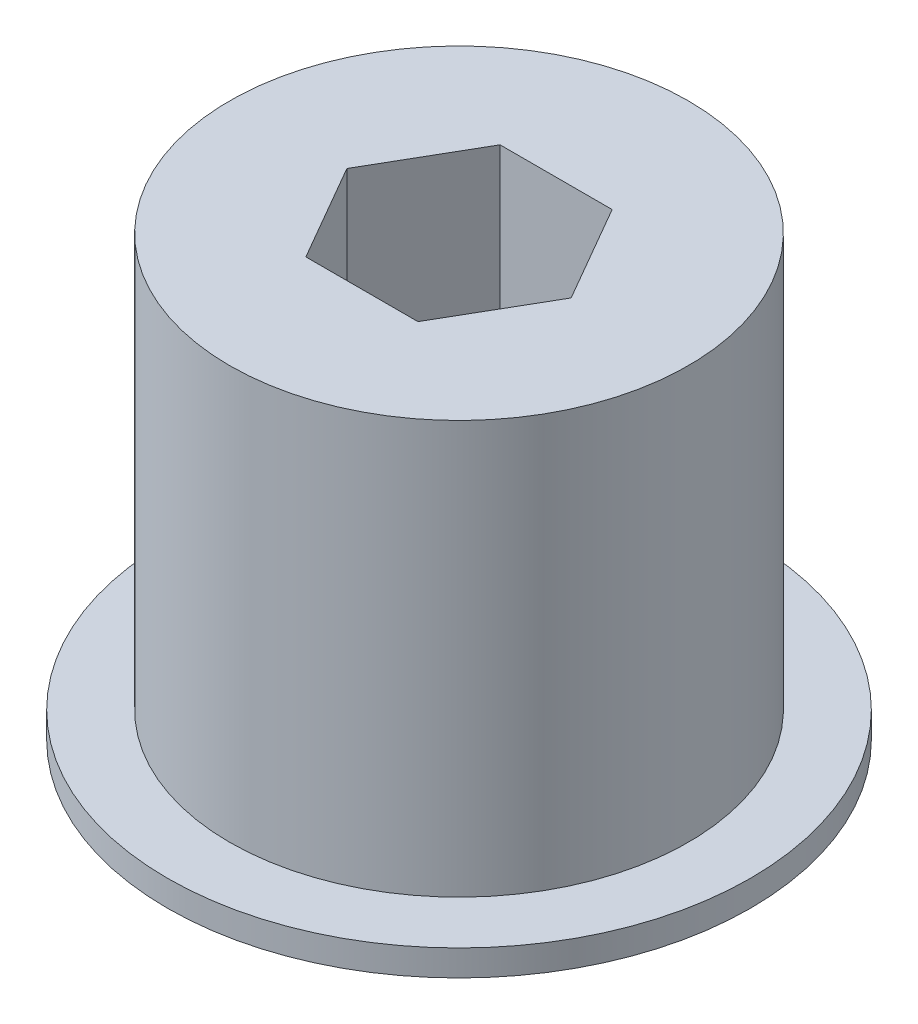
from build123d import *

# Parameters (mm, degrees)
SKETCH1_R           = 15
BOSS_EXTRUDE1_DEPTH = 27
SKETCH2_R           = 19.07
BOSS_EXTRUDE2_DEPTH = 1.7
CUT_EXTRUDE1_DEPTH  = 40.382988713


with BuildPart() as part:
    # Sketch1 → Boss-Extrude1 (new body)
    with BuildSketch(Plane(origin=(0, 0, 0), x_dir=(1, 0, 0), z_dir=(0, 1, 0))):
        with Locations(Location((0, 0, 0), (0, 0, 270))):
            Circle(SKETCH1_R)
    extrude(amount=BOSS_EXTRUDE1_DEPTH)

    # Sketch2 → Boss-Extrude2 (add)
    with BuildSketch(Plane.XZ):
        with Locations(Location((0, 0, 0), (0, 0, 270))):
            Circle(SKETCH2_R)
    extrude(amount=BOSS_EXTRUDE2_DEPTH)

    # Sketch3 → Cut-Extrude1 (cut, through all)
    with BuildSketch(Plane.XZ.offset(1.7)):
        Polygon((-3.666174209, 6.35), (-7.332348419, 0), (-3.666174209, -6.35), (3.666174209, -6.35), (7.332348419, 0), (3.666174209, 6.35), align=None)
    extrude(amount=-CUT_EXTRUDE1_DEPTH, mode=Mode.SUBTRACT)


solid = part.part
